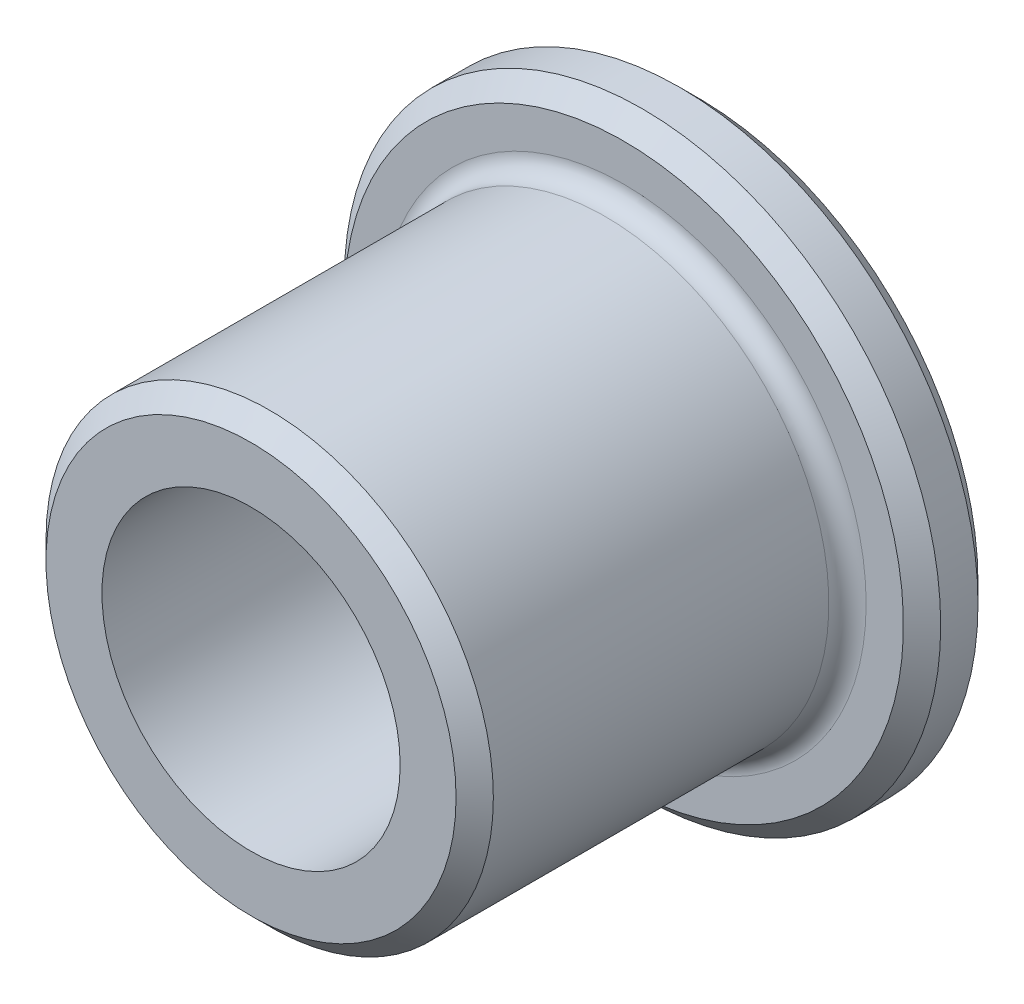
from build123d import *

# Parameters (mm, degrees)
ESQUISSE1_R      = 6
EXTRUSION1_DEPTH = 12
ESQUISSE2_R      = 4
EXTRUSION2_DEPTH = 15.696938457
ESQUISSE3_W      = 4
ESQUISSE3_H      = 2
CHANFREIN1_SIZE  = 0.5
CONG_1_R         = 0.5


with BuildPart() as part:
    # Esquisse1 → Extrusion1 (new body)
    with BuildSketch(Plane.XY):
        Circle(ESQUISSE1_R)
    extrude(amount=EXTRUSION1_DEPTH)

    # Esquisse2 → Extrusion2 (cut, through all)
    with BuildSketch(Plane.XY.offset(12)):
        Circle(ESQUISSE2_R)
    extrude(amount=-EXTRUSION2_DEPTH, mode=Mode.SUBTRACT)

    # Esquisse3 → Révolution2 (revolve)
    with BuildSketch(Plane(origin=(0, 0, 0), x_dir=(1, 0, 0), z_dir=(0, 1, 0)), mode=Mode.PRIVATE) as r_volution2_sk:
        with Locations((6, -1)):
            Rectangle(ESQUISSE3_W, ESQUISSE3_H)
    revolve(r_volution2_sk.sketch.rotate(Axis((0, 0, -1.456374096), (0, 0, 1)), 180), axis=Axis((0, 0, -1.456374096), (0, 0, 1)))

    # Chanfrein1
    chanfrein1_edges = [part.edges().sort_by_distance(p)[0] for p in [
        (8, 0, 0),
        (8, 0, 2),
        (-6, 0, 12),
    ]]
    chamfer(chanfrein1_edges, length=CHANFREIN1_SIZE)

    # Congé1
    cong_1_edges = [part.edges().sort_by_distance(p)[0] for p in [
        (-6, 0, 2),
    ]]
    fillet(cong_1_edges, radius=CONG_1_R)


solid = part.part
